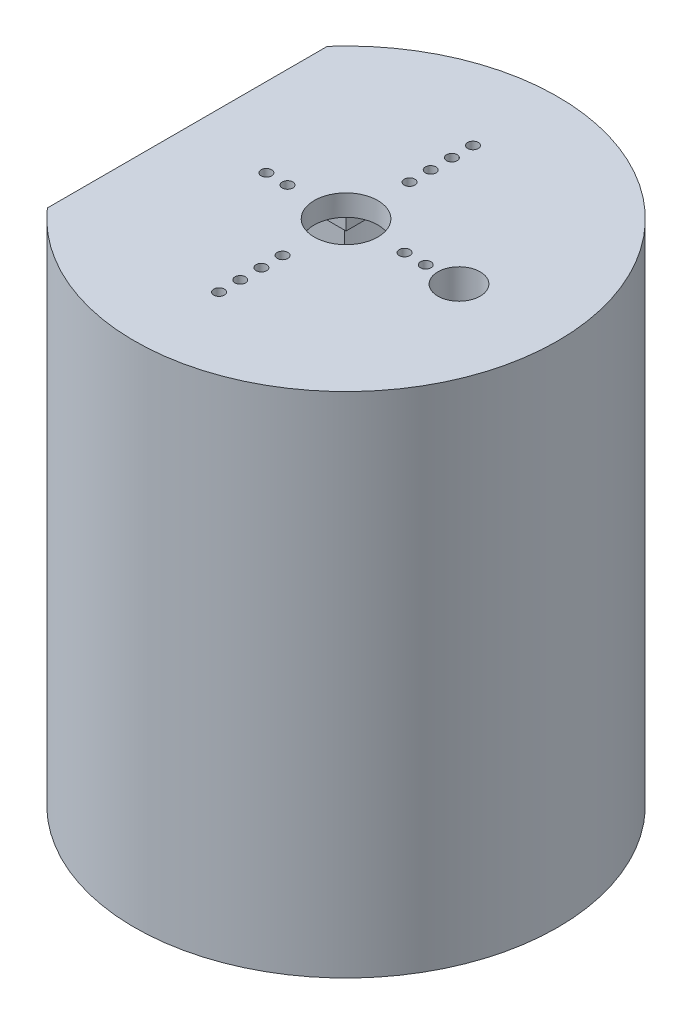
from build123d import *

# Parameters (mm, degrees)
SKETCH_1_R           = 20
SKETCH_1_R_2         = 16
EXTRUDE_1_DEPTH      = 40
SKETCH_2_R           = 20
EXTRUDE_2_DEPTH      = 4
SKETCH_3_R           = 3
CUT_EXTRUDE_1_DEPTH  = 4
CUT_EXTRUDE_2_DEPTH  = 2
EXTRUDE_START        = 4
SKETCH_7_R           = 20
EXTRUDE_3_DEPTH      = 4
SKETCH_8_R           = 1.5
CUT_EXTRUDE_4_DEPTH  = 6
SKETCH_10_W          = 10
SKETCH_10_H          = 30
CUT_EXTRUDE_6_DEPTH  = 48
SKETCH_11_W          = 22.45751311
SKETCH_11_H          = 40
CUT_EXTRUDE_9_DEPTH  = 25
CUT_EXTRUDE_10_DEPTH = 2
SKETCH_14_R          = 2
CUT_EXTRUDE_11_DEPTH = 4
CUT_EXTRUDE_12_DEPTH = 2
SKETCH_16_R          = 0.5
CUT_EXTRUDE_13_DEPTH = 55


with BuildPart() as part:
    # 草图1 → 凸台-拉伸1 (new body)
    with BuildSketch(Plane(origin=(0, 0, 0), x_dir=(1, 0, 0), z_dir=(0, 1, 0))):
        with Locations(Location((0, 0, 0), (0, 0, 270))):
            Circle(SKETCH_1_R)
        with Locations(Location((0, 0, 0), (0, 0, 270))):
            Circle(SKETCH_1_R_2, mode=Mode.SUBTRACT)
    extrude(amount=EXTRUDE_1_DEPTH)

    # 草图2 → 凸台-拉伸2 (add)
    with BuildSketch(Plane(origin=(0, 40, 0), x_dir=(1, 0, 0), z_dir=(0, 1, 0))):
        with Locations(Location((0, 0, 0), (0, 0, 270))):
            Circle(SKETCH_2_R)
    extrude(amount=EXTRUDE_2_DEPTH)

    # 草图3 → 切除-拉伸1 (cut)
    with BuildSketch(Plane(origin=(0, 44, 0), x_dir=(1, 0, 0), z_dir=(0, 1, 0))):
        with Locations(Location((0, 0, 0), (0, 0, 270))):
            Circle(SKETCH_3_R)
    extrude(amount=-CUT_EXTRUDE_1_DEPTH, mode=Mode.SUBTRACT)

    # 草图5 → 切除-拉伸2 (cut)
    with BuildSketch(Plane.XZ.offset(-40)):
        with BuildLine():
            Line((3, 10), (3, -10))
            ThreePointArc((3, -10), (0, -13), (-3, -10))
            Line((-3, -10), (-3, 10))
            ThreePointArc((-3, 10), (0, 13), (3, 10))
        make_face()
    extrude(amount=-CUT_EXTRUDE_2_DEPTH, mode=Mode.SUBTRACT)

    # 草图7 → 凸台-拉伸3 (add)
    with BuildSketch(Plane.XZ.offset(EXTRUDE_START)):
        with Locations(Location((0, 0, 0), (0, 0, 270))):
            Circle(SKETCH_7_R)
    extrude(amount=-EXTRUDE_3_DEPTH)

    # 草图8 → 切除-拉伸4 (cut)
    with BuildSketch(Plane.XZ.offset(4)):
        with Locations(Location((0, 0, 0), (0, 0, 270))):
            Circle(SKETCH_8_R)
    extrude(amount=-CUT_EXTRUDE_4_DEPTH, mode=Mode.SUBTRACT)

    # 草图10 → 切除-拉伸6 (cut)
    with BuildSketch(Plane(origin=(0, 44, 0), x_dir=(1, 0, 0), z_dir=(0, 1, 0))):
        with Locations((-20, 0)):
            Rectangle(SKETCH_10_W, SKETCH_10_H)
    extrude(amount=-CUT_EXTRUDE_6_DEPTH, mode=Mode.SUBTRACT)

    # 草图11 → 切除-拉伸9 (cut)
    with BuildSketch(Plane.ZY.offset(15)):
        with Locations((0, 20)):
            Rectangle(SKETCH_11_W, SKETCH_11_H)
    extrude(amount=-CUT_EXTRUDE_9_DEPTH, mode=Mode.SUBTRACT)

    # 草图12 → 切除-拉伸10 (cut)
    with BuildSketch(Plane(origin=(0, 0, 0), x_dir=(1, 0, 0), z_dir=(0, 1, 0))):
        Polygon((0, 2.886751346), (-2.5, 1.443375673), (-2.5, -1.443375673), (0, -2.886751346), (2.5, -1.443375673), (2.5, 1.443375673), align=None)
    extrude(amount=-CUT_EXTRUDE_10_DEPTH, mode=Mode.SUBTRACT)

    # 草图14 → 切除-拉伸11 (cut)
    with BuildSketch(Plane.XZ.offset(-40)):
        with Locations(Location((10.674541512, 0, 0), (0, 0, 270))):
            Circle(SKETCH_14_R)
    extrude(amount=-CUT_EXTRUDE_11_DEPTH, mode=Mode.SUBTRACT)

    # 草图15 → 切除-拉伸12 (cut)
    with BuildSketch(Plane.XZ.offset(-40)):
        with BuildLine():
            Line((-7, 3), (5.528448646, 3))
            ThreePointArc((5.528448646, 3), (8.528448646, 0), (5.528448646, -3))
            Line((5.528448646, -3), (-7, -3))
            ThreePointArc((-7, -3), (-10, 0), (-7, 3))
        make_face()
    extrude(amount=-CUT_EXTRUDE_12_DEPTH, mode=Mode.SUBTRACT)

    # 草图16 → 切除-拉伸13 (cut, through all)
    with BuildSketch(Plane.XZ.offset(-42)):
        with Locations(Location((0, 12, 0), (0, 0, 270))):
            Circle(SKETCH_16_R)
        with Locations(Location((0, 10, 0), (0, 0, 270))):
            Circle(SKETCH_16_R)
        with Locations(Location((0, 8, 0), (0, 0, 270))):
            Circle(SKETCH_16_R)
        with Locations(Location((0, 6, 0), (0, 0, 270))):
            Circle(SKETCH_16_R)
        with Locations(Location((-7.531348858, 0, 0), (0, 0, 270))):
            Circle(SKETCH_16_R)
        with Locations(Location((-5.531348858, 0, 0), (0, 0, 270))):
            Circle(SKETCH_16_R)
        with Locations(Location((5.531348858, 0, 0), (0, 0, 90))):
            Circle(SKETCH_16_R)
        with Locations(Location((7.531348858, 0, 0), (0, 0, 90))):
            Circle(SKETCH_16_R)
        with Locations(Location((0, -6, 0), (0, 0, 90))):
            Circle(SKETCH_16_R)
        with Locations(Location((0, -8, 0), (0, 0, 90))):
            Circle(SKETCH_16_R)
        with Locations(Location((0, -10, 0), (0, 0, 90))):
            Circle(SKETCH_16_R)
        with Locations(Location((0, -12, 0), (0, 0, 90))):
            Circle(SKETCH_16_R)
    extrude(amount=-CUT_EXTRUDE_13_DEPTH, mode=Mode.SUBTRACT)


solid = part.part
